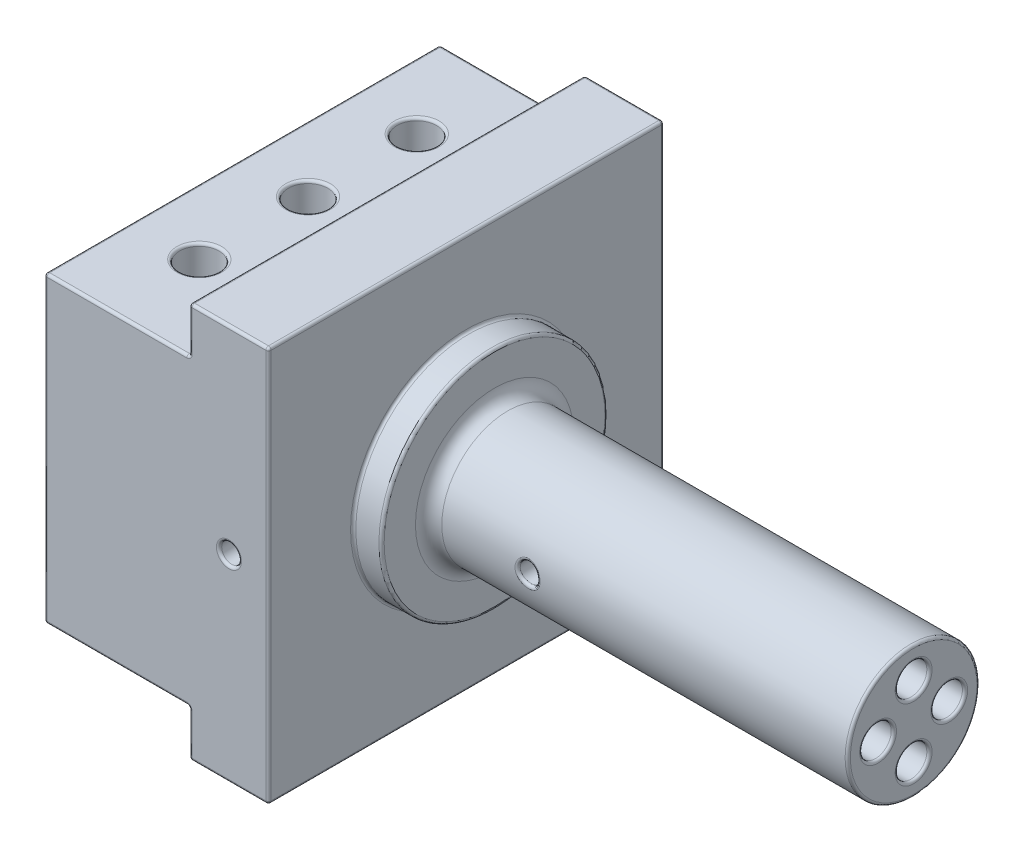
from build123d import *

# Parameters (mm, degrees)
SKETCH1_R               = 10
BOSS_EXTRUDE1_DEPTH     = 63.6
SKETCH2_R               = 17.15
BOSS_EXTRUDE2_DEPTH     = 4.3
FILLET1_R               = 2
SKETCH3_W               = 60
SKETCH3_H               = 60
BOSS_EXTRUDE3_DEPTH     = 12
SKETCH4_R               = 2.4
CUT_EXTRUDE1_DEPTH      = 5.7
SKETCH6_W               = 60
SKETCH6_H               = 46
BOSS_EXTRUDE4_DEPTH     = 22
SKETCH7_R               = 3
CUT_EXTRUDE2_DEPTH      = 89.056572725
SKETCH8_R               = 1.5
CUT_EXTRUDE3_DEPTH      = 5
CUT_EXTRUDE5_DEPTH      = 77.452338094
CUT_EXTRUDE5_DEPTH_BACK = 77.452338094
SKETCH10_R              = 1.5
FILLET2_R               = 0.4


with BuildPart() as part:
    # Sketch1 → Boss-Extrude1 (new body)
    with BuildSketch(Plane(origin=(0, 0, 0), x_dir=(0, 0, -1), z_dir=(1, 0, 0))):
        Circle(SKETCH1_R)
    extrude(amount=BOSS_EXTRUDE1_DEPTH)

    # Sketch2 → Boss-Extrude2 (add)
    with BuildSketch(Plane.ZY):
        with Locations(Location((0, 0, 0), (0, 0, 180))):
            Circle(SKETCH2_R)
    extrude(amount=BOSS_EXTRUDE2_DEPTH)

    # Fillet1
    fillet1_edges = [part.edges().sort_by_distance(p)[0] for p in [
        (0, 0, 10),
    ]]
    fillet(fillet1_edges, radius=FILLET1_R)

    # Sketch3 → Boss-Extrude3 (add)
    with BuildSketch(Plane.ZY.offset(4.3)):
        Rectangle(SKETCH3_W, SKETCH3_H)
    extrude(amount=BOSS_EXTRUDE3_DEPTH)

    # Sketch4 → Cut-Extrude1 (cut)
    with BuildSketch(Plane(origin=(63.6, 0, 0), x_dir=(0, 0, -1), z_dir=(1, 0, 0))):
        with Locations((0, -5.4)):
            Circle(SKETCH4_R)
        with Locations((-5.4, 0)):
            Circle(SKETCH4_R)
        with Locations((0, 5.4)):
            Circle(SKETCH4_R)
        with Locations((5.4, 0)):
            Circle(SKETCH4_R)
    extrude(amount=-CUT_EXTRUDE1_DEPTH, mode=Mode.SUBTRACT)

    # Sketch6 → Boss-Extrude4 (add)
    with BuildSketch(Plane.ZY.offset(16.3)):
        Rectangle(SKETCH6_W, SKETCH6_H)
    extrude(amount=BOSS_EXTRUDE4_DEPTH)

    # Sketch7 → Cut-Extrude2 (cut, through all)
    with BuildSketch(Plane.XZ.offset(23)):
        with Locations(Location((-28.3, -16.5, 0), (0, 0, 270))):
            Circle(SKETCH7_R)
        with Locations(Location((-28.3, 0, 0), (0, 0, 270))):
            Circle(SKETCH7_R)
        with Locations(Location((-28.3, 16.5, 0), (0, 0, 270))):
            Circle(SKETCH7_R)
    extrude(amount=-CUT_EXTRUDE2_DEPTH, mode=Mode.SUBTRACT)

    # Sketch8 → Cut-Extrude3 (cut)
    with BuildSketch(Plane(origin=(0, 0, -30), x_dir=(-1, 0, 0), z_dir=(0, 0, -1))):
        with Locations(Location((10.3, 0, 0), (0, 0, 90))):
            Circle(SKETCH8_R)
    cut_extrude3 = extrude(amount=-CUT_EXTRUDE3_DEPTH, mode=Mode.SUBTRACT)

    # Mirror1: Cut-Extrude3 across plane
    add(cut_extrude3.mirror(Plane.XY), mode=Mode.SUBTRACT)

    # Sketch10 → Cut-Extrude5 (cut, two sides: drawn at the far end of the back side and taken through both)
    with BuildSketch(Plane.XY.offset(-CUT_EXTRUDE5_DEPTH_BACK)):
        with Locations((15, 0)):
            Circle(SKETCH10_R)
    extrude(amount=CUT_EXTRUDE5_DEPTH + CUT_EXTRUDE5_DEPTH_BACK, mode=Mode.SUBTRACT)

    # Fillet2
    fillet2_edges = [part.edges().sort_by_distance(p)[0] for p in [
        (-4.3, 0, 30),
        (-10.3, -30, 30),
        (-4.3, 30, 0),
        (-10.3, 30, 30),
        (-4.3, 0, -30),
        (-10.3, 30, -30),
        (-4.3, -30, 0),
        (-10.3, -30, -30),
        (-16.3, -26.5, 30),
        (-16.3, 30, 0),
        (-16.3, 26.5, -30),
        (-16.3, -30, 0),
        (57.9, -5.4, 2.4),
        (63.6, -5.4, 2.4),
        (57.9, 0, 7.8),
        (63.6, 0, 7.8),
        (57.9, 5.4, 2.4),
        (63.6, 5.4, 2.4),
        (57.9, 0, -3),
        (63.6, 0, -3),
        (-16.3, 26.5, 30),
        (63.6, 0, 10),
        (-16.3, -26.5, -30),
        (-27.3, -23, 30),
        (-16.3, 23, 0),
        (-27.3, 23, 30),
        (-27.3, 23, -30),
        (-16.3, -23, 0),
        (-27.3, -23, -30),
        (-38.3, 0, 30),
        (-38.3, 23, 0),
        (-38.3, 0, -30),
        (-38.3, -23, 0),
        (0, 0, 17.15),
        (-28.3, 23, -13.5),
        (-28.3, -23, -13.5),
        (-4.3, 0, 17.15),
        (-28.3, 23, 3),
        (-28.3, -23, 3),
        (-28.3, 23, 19.5),
        (-28.3, -23, 19.5),
        (-10.3, -1.5, -25),
        (-10.3, -1.5, -30),
        (-10.3, -1.5, 30),
        (-10.3, -1.5, 25),
        (15, -1.5, -9.886859967),
        (13.5, 0, 10),
    ]]
    fillet(fillet2_edges, radius=FILLET2_R)


solid = part.part
